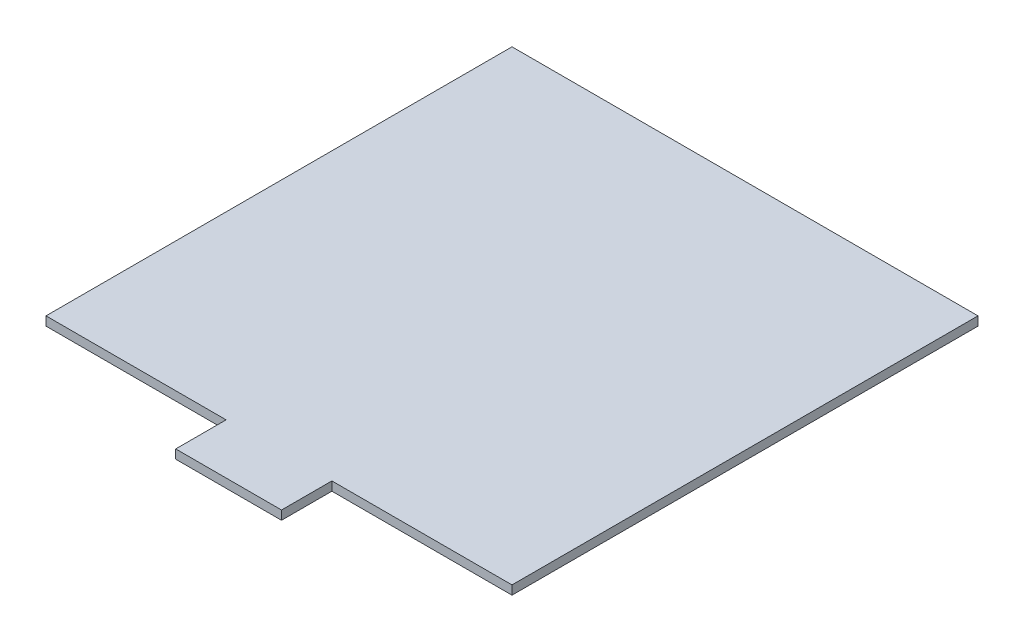
from build123d import *

# Parameters (mm, degrees)
SKETCH1_W           = 39
SKETCH1_H           = 39
BOSS_EXTRUDE1_DEPTH = 0.778
BOSS_EXTRUDE2_DEPTH = 0.9
FILLET1_R           = 0.75
SKETCH3_W           = 44.49
SKETCH3_H           = 44.49
SKETCH3_W_2         = 42.49
SKETCH3_H_2         = 42.49
CUT_EXTRUDE1_DEPTH  = 0.5
SKETCH7_W           = 42.49
SKETCH7_H           = 42.49
BOSS_EXTRUDE5_DEPTH = 0.5


with BuildPart() as part:
    # Sketch1 → Boss-Extrude1 (new body)
    with BuildSketch(Plane(origin=(0, 0, 0), x_dir=(1, 0, 0), z_dir=(0, 1, 0))):
        Rectangle(SKETCH1_W, SKETCH1_H)
    extrude(amount=BOSS_EXTRUDE1_DEPTH)

    # Sketch2 → Boss-Extrude2 (add)
    with BuildSketch(Plane(origin=(0, 0.778, 0), x_dir=(1, 0, 0), z_dir=(0, 1, 0))):
        Polygon((5.334, -23.495), (23.495, -23.495), (23.495, 23.495), (-23.495, 23.495), (-23.495, -23.495), (-5.334, -23.495), (-5.334, -28.575), (5.334, -28.575), align=None)
    extrude(amount=BOSS_EXTRUDE2_DEPTH)

    # Fillet1
    fillet1_edges = [part.edges().sort_by_distance(p)[0] for p in [
        (0, 0, 19.5),
        (-19.5, 0, 0),
        (0, 0, -19.5),
        (19.5, 0, 0),
        (19.5, 0.389, 19.5),
        (-19.5, 0.389, 19.5),
        (-19.5, 0.389, -19.5),
        (19.5, 0.389, -19.5),
    ]]
    fillet(fillet1_edges, radius=FILLET1_R)

    # Sketch3 → Cut-Extrude1 (cut)
    with BuildSketch(Plane.XZ.offset(-0.778)):
        Rectangle(SKETCH3_W, SKETCH3_H)
        Rectangle(SKETCH3_W_2, SKETCH3_H_2, mode=Mode.SUBTRACT)
    extrude(amount=-CUT_EXTRUDE1_DEPTH, mode=Mode.SUBTRACT)


with BuildPart() as body_2:
    # Sketch7 → Boss-Extrude5 (new body)
    with BuildSketch(Plane.XZ.offset(-0.778)):
        Rectangle(SKETCH7_W, SKETCH7_H)
        with BuildLine():
            Line((-18.75, 19.5), (18.75, 19.5))
            ThreePointArc((18.75, 19.5), (19.280330086, 19.280330086), (19.5, 18.75))
            Line((19.5, 18.75), (19.5, -18.75))
            ThreePointArc((19.5, -18.75), (19.280330086, -19.280330086), (18.75, -19.5))
            Line((18.75, -19.5), (-18.75, -19.5))
            ThreePointArc((-18.75, -19.5), (-19.280330086, -19.280330086), (-19.5, -18.75))
            Line((-19.5, -18.75), (-19.5, 18.75))
            ThreePointArc((-19.5, 18.75), (-19.280330086, 19.280330086), (-18.75, 19.5))
        make_face(mode=Mode.SUBTRACT)
    extrude(amount=BOSS_EXTRUDE5_DEPTH)


solid = Compound([part.part, body_2.part])
